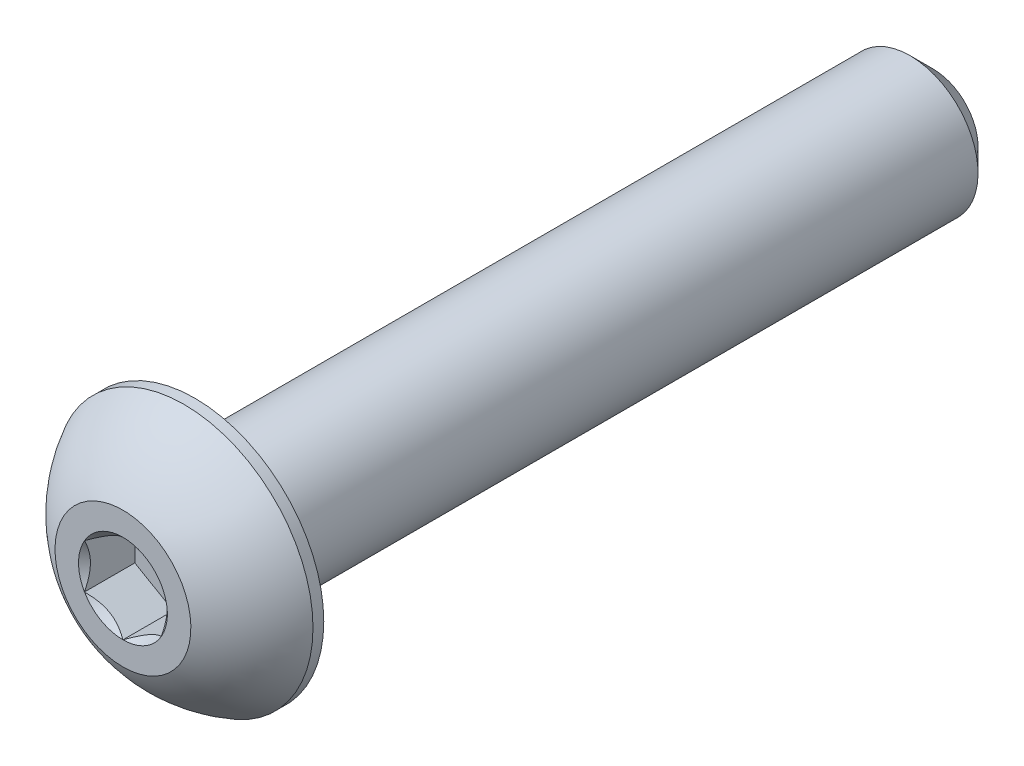
from build123d import *

# Parameters (mm, degrees)
SKETCH1_W          = 19.05
SKETCH1_H          = 1.7526
CHAMFER1_SIZE      = 0.5953125
CUT_EXTRUDE2_DEPTH = 1.29794


with BuildPart() as part:
    # Sketch1 → Revolve1 (revolve)
    with BuildSketch(Plane(origin=(0, 0, 0), x_dir=(0, 0, -1), z_dir=(1, 0, 0))):
        with Locations((11.3792, 0.8763)):
            Rectangle(SKETCH1_W, SKETCH1_H)
    revolve(axis=Axis((0, 0, -20.9042), (0, 0, 1)))

    # Chamfer1
    chamfer1_edges = [part.edges().sort_by_distance(p)[0] for p in [
        (0, -1.7526, -20.9042),
    ]]
    chamfer(chamfer1_edges, length=CHAMFER1_SIZE)

    # Sketch7 → Revolve2 (revolve)
    with BuildSketch(Plane(origin=(0, 0, 0), x_dir=(0, 0, -1), z_dir=(1, 0, 0))):
        with BuildLine():
            Line((1.57607, 3.3274), (1.8542, 3.3274))
            Line((1.8542, 3.3274), (1.8542, 0))
            Line((1.8542, 0), (0, 0))
            Line((0, 0), (0, 1.7526))
            ThreePointArc((0, 1.7526), (0.668695369, 2.659435873), (1.57607, 3.3274))
        make_face()
    revolve(axis=Axis((0, 0, 0), (0, 0, -1)))

    # Sketch5 → Cut-Extrude2 (cut)
    with BuildSketch(Plane.XY):
        Polygon((0.9921875, -0.57283972), (0.9921875, 0.57283972), (0, 1.14567944), (-0.9921875, 0.57283972), (-0.9921875, -0.57283972), (0, -1.14567944), align=None)
    extrude(amount=-CUT_EXTRUDE2_DEPTH, mode=Mode.SUBTRACT)

    # Cut-Extrude3 cone 1 section (through the dimple's axis) → Cut-Extrude3 (revolve, cut)
    with BuildSketch(Plane(origin=(0, 0, 0), x_dir=(0, -1, 0), z_dir=(1, 0, 0))):
        Polygon((0, 0), (1.14567944, 0), (0, 1.14567944), align=None)
    revolve(axis=Axis((0, 0, 0), (0, 0, -1)), mode=Mode.SUBTRACT)


solid = part.part
